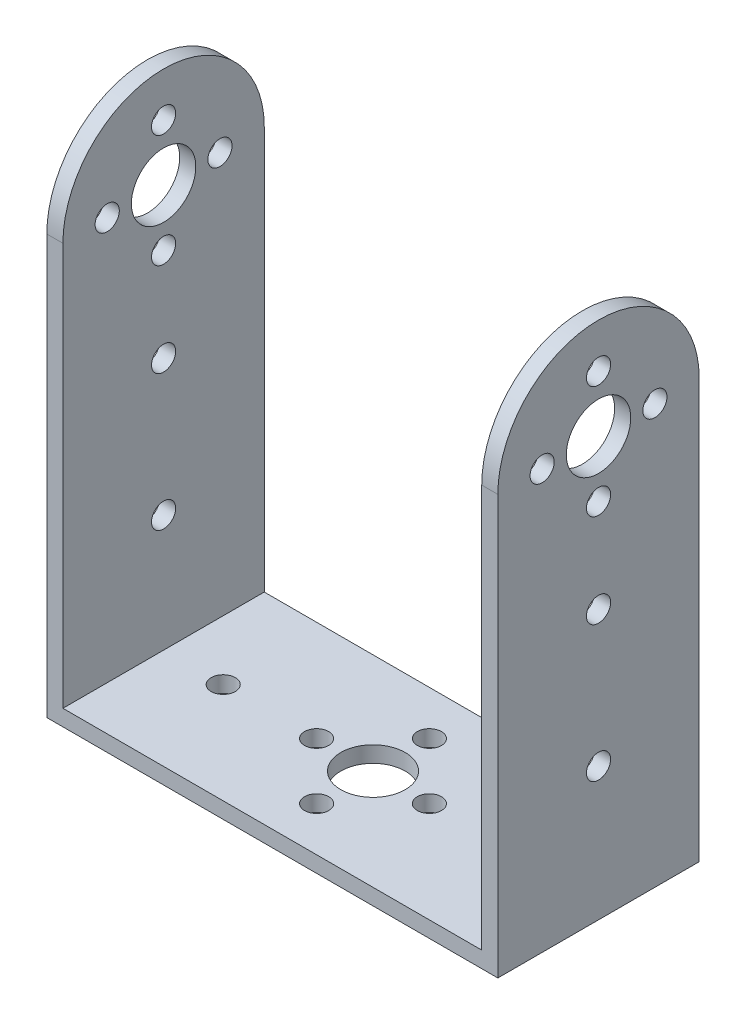
from build123d import *

# Parameters (mm, degrees)
SKETCH_1_W          = 56
SKETCH_1_H          = 25
EXTRUDE_1_DEPTH     = 2
SKETCH_2_R          = 4
SKETCH_2_R_2        = 1.5
CUT_EXTRUDE_1_DEPTH = 39.082744359
EXTRUDE_2_DEPTH     = 2
CUT_EXTRUDE_2_REACH = 88.437
SKETCH_4_R          = 1.5
SKETCH_4_R_2        = 4


with BuildPart() as part:
    # 草图1 → 凸台-拉伸1 (new body)
    with BuildSketch(Plane(origin=(0, 0, 0), x_dir=(1, 0, 0), z_dir=(0, 1, 0))):
        with Locations((7.654255319, 0.731382979)):
            Rectangle(SKETCH_1_W, SKETCH_1_H)
    extrude(amount=EXTRUDE_1_DEPTH)

    # 草图2 → 切除-拉伸1 (cut, through all)
    with BuildSketch(Plane(origin=(0, 2, 0), x_dir=(1, 0, 0), z_dir=(0, 1, 0))):
        with Locations(Location((7.654255319, 0.731382979, 0), (0, 0, 270))):
            Circle(SKETCH_2_R)
        with Locations(Location((7.654255319, 7.731382979, 0), (0, 0, 270))):
            Circle(SKETCH_2_R_2)
        with Locations(Location((14.654255319, 0.731382979, 0), (0, 0, 270))):
            Circle(SKETCH_2_R_2)
        with Locations(Location((7.654255319, -6.268617021, 0), (0, 0, 270))):
            Circle(SKETCH_2_R_2)
        with Locations(Location((0.654255319, 0.731382979, 0), (0, 0, 270))):
            Circle(SKETCH_2_R_2)
        with Locations(Location((-10.945744681, 0.731382979, 0), (0, 0, 270))):
            Circle(SKETCH_2_R_2)
        with Locations(Location((26.254255319, 0.731382979, 0), (0, 0, 270))):
            Circle(SKETCH_2_R_2)
    extrude(amount=-CUT_EXTRUDE_1_DEPTH, mode=Mode.SUBTRACT)

    # 草图3 → 凸台-拉伸2 (add)
    with BuildSketch(Plane.ZY.offset(20.345744681)):
        with BuildLine():
            Line((-13.231382979, 2), (-13.231382979, 22))
            Line((-13.231382979, 22), (-13.231382979, 52))
            ThreePointArc((-13.231382979, 52), (-0.731382979, 64.5), (11.768617021, 52))
            Line((11.768617021, 52), (11.768617021, 22))
            Line((11.768617021, 22), (11.768617021, 2))
            Line((11.768617021, 2), (-13.231382979, 2))
        make_face()
    extrude_2 = extrude(amount=-EXTRUDE_2_DEPTH)

    # 草图4 → 切除-拉伸2 (cut, up to next)
    with BuildSketch(Plane.ZY.offset(20.345744681), mode=Mode.PRIVATE) as cut_extrude_2_sk1:
        with Locations((-0.731382979, 16.53)):
            Circle(SKETCH_4_R)
    cut_extrude_2_tool1 = extrude(cut_extrude_2_sk1.sketch, amount=-CUT_EXTRUDE_2_REACH, mode=Mode.PRIVATE) & part.part
    # 草图4 → 切除-拉伸2 (cut, up to next)
    with BuildSketch(Plane.ZY.offset(20.345744681), mode=Mode.PRIVATE) as cut_extrude_2_sk2:
        with Locations((-0.731382979, 52)):
            Circle(SKETCH_4_R_2)
    cut_extrude_2_tool2 = extrude(cut_extrude_2_sk2.sketch, amount=-CUT_EXTRUDE_2_REACH, mode=Mode.PRIVATE) & part.part
    # 草图4 → 切除-拉伸2 (cut, up to next)
    with BuildSketch(Plane.ZY.offset(20.345744681), mode=Mode.PRIVATE) as cut_extrude_2_sk3:
        with Locations((-0.731382979, 59)):
            Circle(SKETCH_4_R)
    cut_extrude_2_tool3 = extrude(cut_extrude_2_sk3.sketch, amount=-CUT_EXTRUDE_2_REACH, mode=Mode.PRIVATE) & part.part
    # 草图4 → 切除-拉伸2 (cut, up to next)
    with BuildSketch(Plane.ZY.offset(20.345744681), mode=Mode.PRIVATE) as cut_extrude_2_sk4:
        with Locations((6.268617021, 52)):
            Circle(SKETCH_4_R)
    cut_extrude_2_tool4 = extrude(cut_extrude_2_sk4.sketch, amount=-CUT_EXTRUDE_2_REACH, mode=Mode.PRIVATE) & part.part
    # 草图4 → 切除-拉伸2 (cut, up to next)
    with BuildSketch(Plane.ZY.offset(20.345744681), mode=Mode.PRIVATE) as cut_extrude_2_sk5:
        with Locations((-0.731382979, 45)):
            Circle(SKETCH_4_R)
    cut_extrude_2_tool5 = extrude(cut_extrude_2_sk5.sketch, amount=-CUT_EXTRUDE_2_REACH, mode=Mode.PRIVATE) & part.part
    # 草图4 → 切除-拉伸2 (cut, up to next)
    with BuildSketch(Plane.ZY.offset(20.345744681), mode=Mode.PRIVATE) as cut_extrude_2_sk6:
        with Locations((-7.731382979, 52)):
            Circle(SKETCH_4_R)
    cut_extrude_2_tool6 = extrude(cut_extrude_2_sk6.sketch, amount=-CUT_EXTRUDE_2_REACH, mode=Mode.PRIVATE) & part.part
    # 草图4 → 切除-拉伸2 (cut, up to next)
    with BuildSketch(Plane.ZY.offset(20.345744681), mode=Mode.PRIVATE) as cut_extrude_2_sk7:
        with Locations((-0.731382979, 33.4)):
            Circle(SKETCH_4_R)
    cut_extrude_2_tool7 = extrude(cut_extrude_2_sk7.sketch, amount=-CUT_EXTRUDE_2_REACH, mode=Mode.PRIVATE) & part.part
    cut_extrude_2_1 = cut_extrude_2_tool1.solids().sort_by_distance((-20.345745, 16.53, -0.731383))[0]
    add(cut_extrude_2_1, mode=Mode.SUBTRACT)
    cut_extrude_2_2 = cut_extrude_2_tool2.solids().sort_by_distance((-20.345745, 52, -0.731383))[0]
    add(cut_extrude_2_2, mode=Mode.SUBTRACT)
    cut_extrude_2_3 = cut_extrude_2_tool3.solids().sort_by_distance((-20.345745, 59, -0.731383))[0]
    add(cut_extrude_2_3, mode=Mode.SUBTRACT)
    cut_extrude_2_4 = cut_extrude_2_tool4.solids().sort_by_distance((-20.345745, 52, 6.268617))[0]
    add(cut_extrude_2_4, mode=Mode.SUBTRACT)
    cut_extrude_2_5 = cut_extrude_2_tool5.solids().sort_by_distance((-20.345745, 45, -0.731383))[0]
    add(cut_extrude_2_5, mode=Mode.SUBTRACT)
    cut_extrude_2_6 = cut_extrude_2_tool6.solids().sort_by_distance((-20.345745, 52, -7.731383))[0]
    add(cut_extrude_2_6, mode=Mode.SUBTRACT)
    cut_extrude_2_7 = cut_extrude_2_tool7.solids().sort_by_distance((-20.345745, 33.4, -0.731383))[0]
    add(cut_extrude_2_7, mode=Mode.SUBTRACT)
    cut_extrude_2 = cut_extrude_2_1 + cut_extrude_2_2 + cut_extrude_2_3 + cut_extrude_2_4 + cut_extrude_2_5 + cut_extrude_2_6 + cut_extrude_2_7  # 切除-拉伸2 as one shape, for the pattern or mirror that repeats it

    # 镜向1: 凸台-拉伸2, 切除-拉伸2 across plane
    add(extrude_2.mirror(Plane.ZY.offset(-7.654255319)))
    add(cut_extrude_2.mirror(Plane.ZY.offset(-7.654255319)), mode=Mode.SUBTRACT)


solid = part.part
